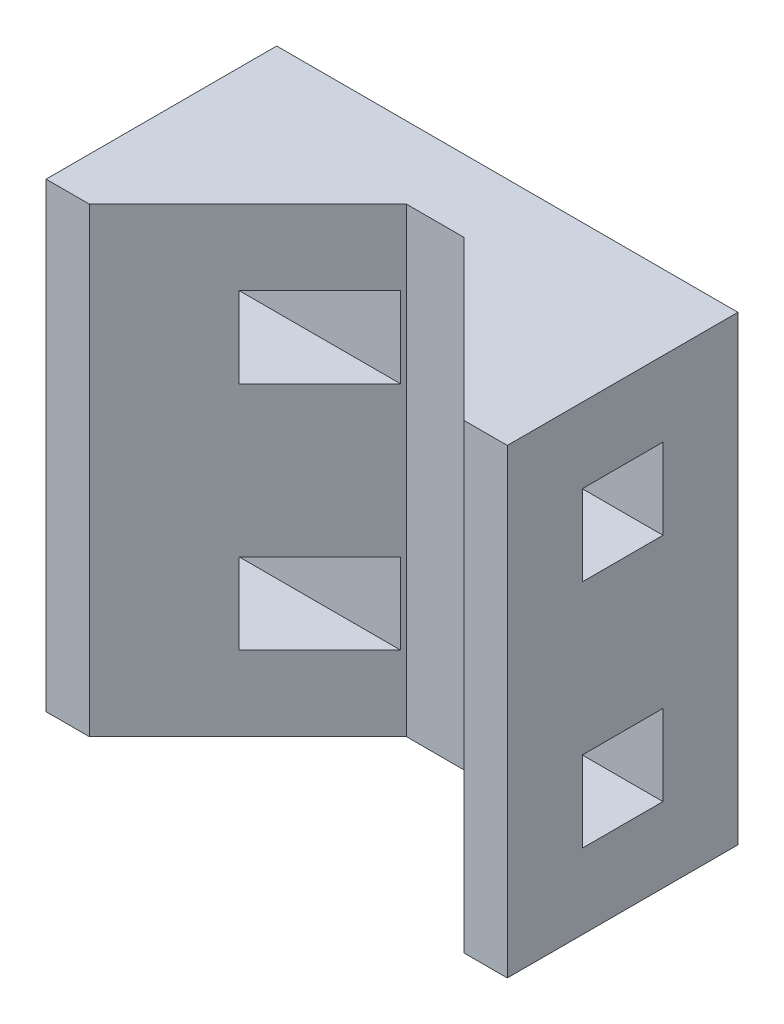
from build123d import *

# Parameters (mm, degrees)
RESSALTO_EXTRUS_O1_DEPTH  = 16
ESBO_O2_W                 = 2.8
ESBO_O2_H                 = 2.8
CORTE_EXTRUS_O1_DEPTH     = 54.103672189
ESBO_O4_W                 = 2.8
ESBO_O4_H                 = 2.8
CORTE_EXTRUS_O2_DEPTH     = 31.186917696
CORPO_MOVER_COPIAR1_ANGLE = 90
ESBO_O6_W                 = 30
ESBO_O6_H                 = 16
CORTE_EXTRUS_O3_DEPTH     = 29.861739379
ESBO_O7_W                 = 25.221413321
ESBO_O7_H                 = 12.57615678
RESSALTO_EXTRUS_O2_DEPTH  = 2.5
ESBO_O8_W                 = 2.8
ESBO_O8_H                 = 2.8
CORTE_EXTRUS_O4_DEPTH     = 29.271009886
ESBO_O10_W                = 32
ESBO_O10_H                = 16
CORTE_EXTRUS_O5_DEPTH     = 10


with BuildPart() as part:
    # Esboço1 → Ressalto-extrusão1 (new body)
    with BuildSketch(Plane.XY):
        Polygon((-25, 0), (25, 0), (25, 8), (23.5, 8), (18, 2.5), (-18, 2.5), (-23.5, 8), (-25, 8), align=None)
    extrude(amount=RESSALTO_EXTRUS_O1_DEPTH)

    # Esboço2 → Corte-extrusão1 (cut, through all)
    with BuildSketch(Plane(origin=(25, 0, 0), x_dir=(0, 0, -1), z_dir=(1, 0, 0))):
        with Locations((-4, 4)):
            Rectangle(ESBO_O2_W, ESBO_O2_H)
        with Locations((-12, 4)):
            Rectangle(ESBO_O2_W, ESBO_O2_H)
    extrude(amount=-CORTE_EXTRUS_O1_DEPTH, mode=Mode.SUBTRACT)

    # Esboço4 → Corte-extrusão2 (cut, through all)
    with BuildSketch(Plane(origin=(0, 2.5, 0), x_dir=(1, 0, 0), z_dir=(0, 1, 0))):
        with Locations((-16, -4)):
            Rectangle(ESBO_O4_W, ESBO_O4_H)
        with Locations((-8, -4)):
            Rectangle(ESBO_O4_W, ESBO_O4_H)
        with Locations((0, -4)):
            Rectangle(ESBO_O4_W, ESBO_O4_H)
        with Locations((8, -4)):
            Rectangle(ESBO_O4_W, ESBO_O4_H)
        with Locations((16, -4)):
            Rectangle(ESBO_O4_W, ESBO_O4_H)
        with Locations((-8, -12)):
            Rectangle(ESBO_O4_W, ESBO_O4_H)
        with Locations((0, -12)):
            Rectangle(ESBO_O4_W, ESBO_O4_H)
        with Locations((8, -12)):
            Rectangle(ESBO_O4_W, ESBO_O4_H)
        with Locations((16, -12)):
            Rectangle(ESBO_O4_W, ESBO_O4_H)
        with Locations((-16, -12)):
            Rectangle(ESBO_O4_W, ESBO_O4_H)
    extrude(amount=-CORTE_EXTRUS_O2_DEPTH, mode=Mode.SUBTRACT)


with BuildPart() as part_1:
    # Corpo-Mover/Copiar1: moved
    add(part.part.rotate(Axis((0, 4, 8), (1, 0, 0)), CORPO_MOVER_COPIAR1_ANGLE))

    # Esboço6 → Corte-extrusão3 (cut, through all)
    with BuildSketch(Plane(origin=(0, 0, 4), x_dir=(-1, 0, 0), z_dir=(0, 0, -1))):
        with Locations((-10, 4)):
            Rectangle(ESBO_O6_W, ESBO_O6_H)
    extrude(amount=-CORTE_EXTRUS_O3_DEPTH, mode=Mode.SUBTRACT)

    # Espelhar3: part across plane


with BuildPart() as part_2:
    add(part_1.part)
    add(part_1.part.mirror(Plane(origin=(-5, -4, 12), x_dir=(0, 0, 1), z_dir=(-1, 0, 0))))

    # Esboço7 → Ressalto-extrusão2 (add, through all)
    with BuildSketch(Plane.XY.offset(6.5)):
        with Locations((-4.971284079, 3.626460754)):
            Rectangle(ESBO_O7_W, ESBO_O7_H)
    extrude(amount=-RESSALTO_EXTRUS_O2_DEPTH)

    # Esboço8 → Corte-extrusão4 (cut, through all)
    with BuildSketch(Plane.XY.offset(6.5)):
        with Locations((-5, 8)):
            Rectangle(ESBO_O8_W, ESBO_O8_H)
        with Locations((-13, 8)):
            Rectangle(ESBO_O8_W, ESBO_O8_H)
        with Locations((3, 8)):
            Rectangle(ESBO_O8_W, ESBO_O8_H)
        with Locations((-5, 0)):
            Rectangle(ESBO_O8_W, ESBO_O8_H)
        with Locations((3, 0)):
            Rectangle(ESBO_O8_W, ESBO_O8_H)
        with Locations((-13, 0)):
            Rectangle(ESBO_O8_W, ESBO_O8_H)
    extrude(amount=-CORTE_EXTRUS_O4_DEPTH, mode=Mode.SUBTRACT)

    # Esboço10 → Corte-extrusão5 (cut)
    with BuildSketch(Plane(origin=(0, 0, 4), x_dir=(-1, 0, 0), z_dir=(0, 0, -1))):
        with Locations((1, 4)):
            Rectangle(ESBO_O10_W, ESBO_O10_H)
    extrude(amount=-CORTE_EXTRUS_O5_DEPTH, mode=Mode.SUBTRACT)

    # Espelhar4: part across plane


with BuildPart() as part_3:
    add(part_2.part)
    add(part_2.part.mirror(Plane(origin=(-17, -4, 14), x_dir=(0, 0, 1), z_dir=(-1, 0, 0))))


solid = part_3.part
